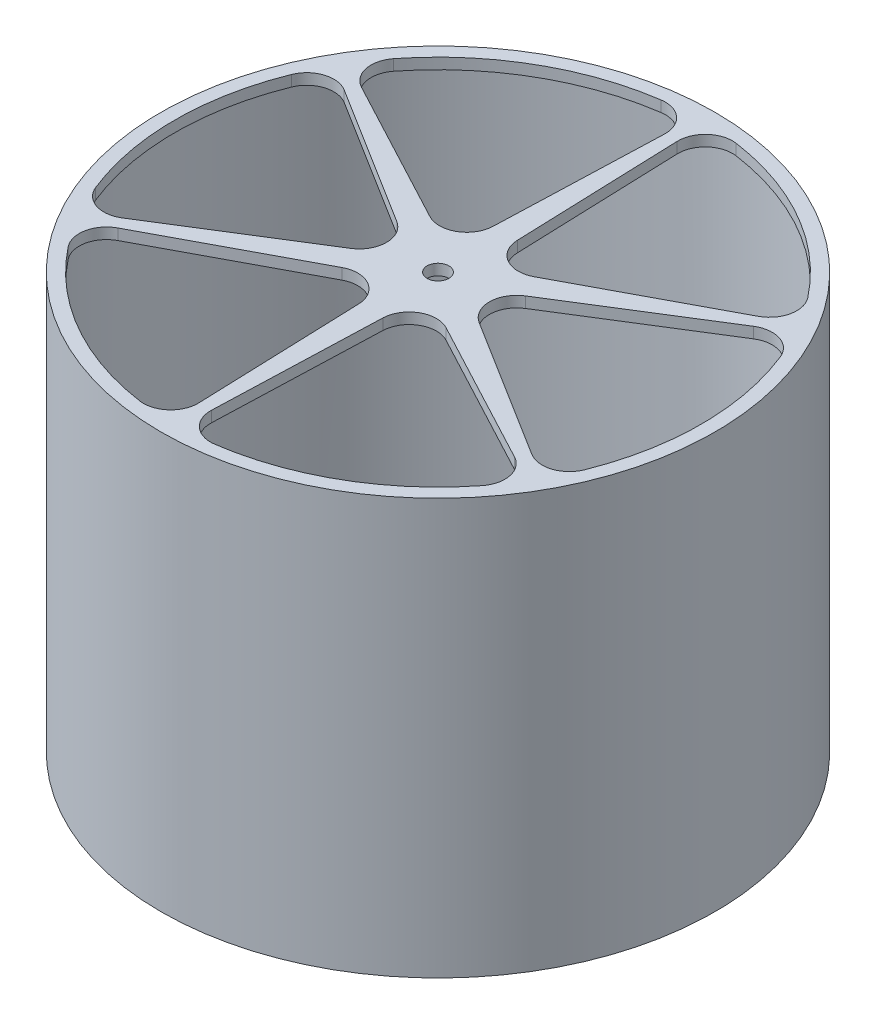
from build123d import *

# Parameters (mm, degrees)
SKETCH1_R           = 101.6
BOSS_EXTRUDE1_DEPTH = 4
CUT_EXTRUDE2_DEPTH  = 144.739764853
CIRPATTERN1_COUNT   = 6
SKETCH5_R           = 4
CUT_EXTRUDE3_DEPTH  = 144.739764853
BOSS_EXTRUDE2_START = 148.4
SKETCH6_R           = 101.6
SKETCH6_R_2         = 100.6
BOSS_EXTRUDE2_DEPTH = 148.4
FILLET1_R           = 2


with BuildPart() as part:
    # Sketch1 → Boss-Extrude1 (new body)
    with BuildSketch(Plane(origin=(0, 0, 0), x_dir=(1, 0, 0), z_dir=(0, 1, 0))):
        with Locations(Location((0, 0, 0), (0, 0, 270))):
            Circle(SKETCH1_R)
    extrude(amount=BOSS_EXTRUDE1_DEPTH)

    # Sketch2 → Cut-Extrude2 (cut, through all)
    with BuildSketch(Plane(origin=(0, 0, 0), x_dir=(1, 0, 0), z_dir=(0, 1, 0))):
        with BuildLine():
            Line((23.571606506, 8.480480962), (75.093958746, 40.675219815))
            ThreePointArc((75.093958746, 40.675219815), (83.497889012, 41.700558349), (89.676425221, 35.912376134))
            ThreePointArc((89.676425221, 35.912376134), (96.6, 0), (89.676425221, -35.912376134))
            ThreePointArc((89.676425221, -35.912376134), (83.497889012, -41.700558349), (75.093958746, -40.675219815))
            Line((75.093958746, -40.675219815), (23.571606506, -8.480480962))
            ThreePointArc((23.571606506, -8.480480962), (18.870799148, 0), (23.571606506, 8.480480962))
        make_face()
    cut_extrude2 = extrude(amount=CUT_EXTRUDE2_DEPTH, mode=Mode.SUBTRACT)

    # CirPattern1: Cut-Extrude2 ×6 about axis
    cirpattern1_axis = Axis((0, 0, 0), (0, 1, 0))
    for i in range(1, CIRPATTERN1_COUNT):
        add(cut_extrude2.rotate(cirpattern1_axis, i * 360 / CIRPATTERN1_COUNT), mode=Mode.SUBTRACT)

    # Sketch5 → Cut-Extrude3 (cut, through all)
    with BuildSketch(Plane(origin=(0, 0, 0), x_dir=(1, 0, 0), z_dir=(0, 1, 0))):
        with Locations(Location((0, 0, 0), (0, 0, 270))):
            Circle(SKETCH5_R)
    extrude(amount=CUT_EXTRUDE3_DEPTH, mode=Mode.SUBTRACT)

    # Sketch6 → Boss-Extrude2 (add)
    with BuildSketch(Plane.XZ.offset(BOSS_EXTRUDE2_START)):
        with Locations(Location((0, 0, 0), (0, 0, 270))):
            Circle(SKETCH6_R)
        with Locations(Location((0, 0, 0), (0, 0, 270))):
            Circle(SKETCH6_R_2, mode=Mode.SUBTRACT)
    extrude(amount=-BOSS_EXTRUDE2_DEPTH)

    # Fillet1
    fillet1_edges = [part.edges().sort_by_distance(p)[0] for p in [
        (0, 0, 100.6),
    ]]
    fillet(fillet1_edges, radius=FILLET1_R)


solid = part.part
